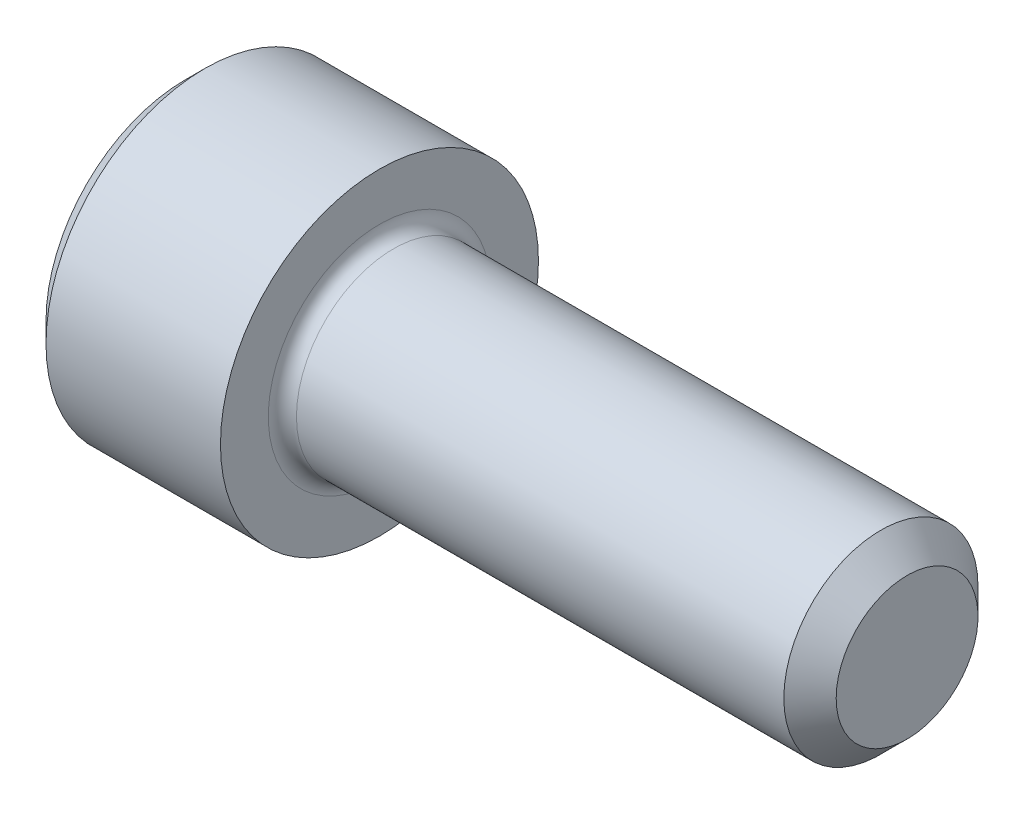
from build123d import *

# Parameters (mm, degrees)
FILLET1_R   = 0.254
HEX_2_DEPTH = 1.6256


with BuildPart() as part:
    # BodySke → Base-Revolve (revolve)
    with BuildSketch(Plane.XY, mode=Mode.PRIVATE) as base_revolve_sk:
        Polygon((0, 0), (0, 2.5146), (0.3556, 2.8702), (3.5052, 2.8702), (3.5052, 1.7526), (12.55776, 1.7526), (13.0302, 1.28016), (13.0302, 0), align=None)
    revolve(base_revolve_sk.sketch.rotate(Axis((-31.75, 0, 0), (1, 0, 0)), 90), axis=Axis((-31.75, 0, 0), (1, 0, 0)))

    # Fillet1
    fillet1_edges = [part.edges().sort_by_distance(p)[0] for p in [
        (3.5052, 0, -1.7526),
    ]]
    fillet(fillet1_edges, radius=FILLET1_R)

    # Sketch2 → Hex-PreBroach (revolve, cut)
    with BuildSketch(Plane.XY, mode=Mode.PRIVATE) as hex_prebroach_sk:
        Polygon((0, 1.3843), (1.6256, 1.3843), (2.424825978, 0), (0, 0), align=None)
    revolve(hex_prebroach_sk.sketch.rotate(Axis((0, 0, 0), (1, 0, 0)), 90), axis=Axis((0, 0, 0), (1, 0, 0)), mode=Mode.SUBTRACT)

    # Sketch3 → Hex 2 (cut)
    with BuildSketch(Plane(origin=(0, 0, 0), x_dir=(0, 0.500000000000001, 0.866025403784438), z_dir=(-1, 0, 0))):
        Polygon((0.799225978, 1.3843), (-0.799225978, 1.3843), (-1.598451955, 0), (-0.799225978, -1.3843), (0.799225978, -1.3843), (1.598451955, 0), align=None)
    extrude(amount=-HEX_2_DEPTH, mode=Mode.SUBTRACT)


solid = part.part
